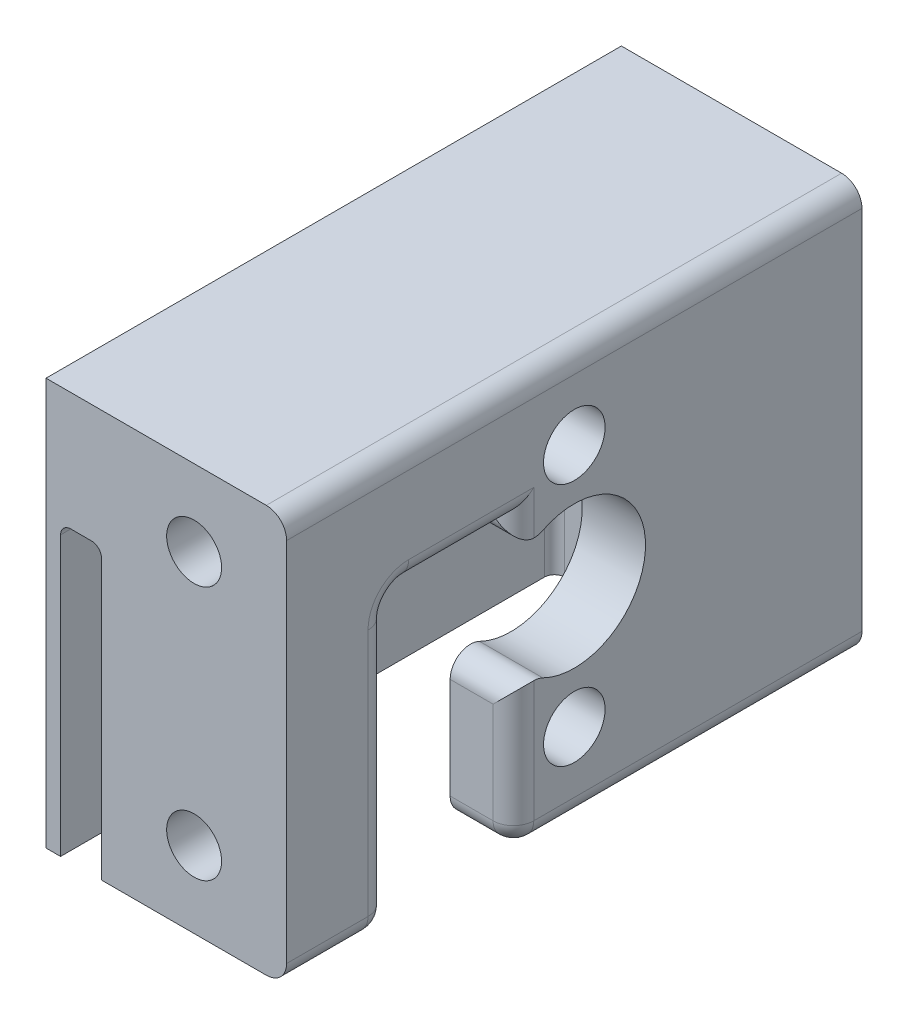
from build123d import *

# Parameters (mm, degrees)
SKETCH1_W           = 23.65
SKETCH1_H           = 40
BOSS_EXTRUDE1_DEPTH = 56.55
SKETCH2_W           = 16
SKETCH2_H           = 28.38
CUT_EXTRUDE1_DEPTH  = 62.137002911
SKETCH3_R           = 7
CUT_EXTRUDE2_DEPTH  = 6.2205
SKETCH6_R           = 3.025
CUT_EXTRUDE4_DEPTH  = 8
SKETCH4_W           = 11.968
SKETCH4_H           = 10
BOSS_EXTRUDE2_DEPTH = 28.38
SKETCH5_W           = 12.292
SKETCH5_H           = 28.38
CUT_EXTRUDE3_DEPTH  = 6.2205
FILLET5_R           = 2
SKETCH9_W           = 8
SKETCH9_H           = 11
BOSS_EXTRUDE3_DEPTH = 16
SKETCH8_R           = 2.7
CUT_EXTRUDE6_DEPTH  = 9
SKETCH7_R           = 2.7
CUT_EXTRUDE5_DEPTH  = 8
FILLET4_R           = 2
FILLET8_R           = 1


with BuildPart() as part:
    # Sketch1 → Boss-Extrude1 (new body)
    with BuildSketch(Plane.XY):
        Rectangle(SKETCH1_W, SKETCH1_H)
    extrude(amount=BOSS_EXTRUDE1_DEPTH)

    # Sketch2 → Cut-Extrude1 (cut, through all)
    with BuildSketch(Plane.XY.offset(56.55)):
        with Locations((-2.3955, -5.81)):
            Rectangle(SKETCH2_W, SKETCH2_H)
    extrude(amount=-CUT_EXTRUDE1_DEPTH, mode=Mode.SUBTRACT)

    # Sketch3 → Cut-Extrude2 (cut)
    with BuildSketch(Plane(origin=(11.825, 0, 0), x_dir=(0, 0, -1), z_dir=(1, 0, 0))):
        with Locations(Location((-28.275, 0, 0), (0, 0, 90))):
            Circle(SKETCH3_R)
    extrude(amount=-CUT_EXTRUDE2_DEPTH, mode=Mode.SUBTRACT)

    # Sketch6 → Cut-Extrude4 (cut)
    with BuildSketch(Plane(origin=(11.825, 0, 0), x_dir=(0, 0, -1), z_dir=(1, 0, 0))):
        with Locations(Location((-28.275, 12, 0), (0, 0, 90))):
            Circle(SKETCH6_R)
        with Locations(Location((-28.275, -12, 0), (0, 0, 90))):
            Circle(SKETCH6_R)
    extrude(amount=-CUT_EXTRUDE4_DEPTH, mode=Mode.SUBTRACT)

    # Sketch4 → Boss-Extrude2 (add)
    with BuildSketch(Plane.XZ.offset(-8.38)):
        with Locations((-0.3795, 51.55)):
            Rectangle(SKETCH4_W, SKETCH4_H)
    extrude(amount=BOSS_EXTRUDE2_DEPTH)

    # Sketch5 → Cut-Extrude3 (cut)
    with BuildSketch(Plane(origin=(11.825, 0, 0), x_dir=(0, 0, -1), z_dir=(1, 0, 0))):
        with Locations((-40.404, -5.81)):
            Rectangle(SKETCH5_W, SKETCH5_H)
    extrude(amount=-CUT_EXTRUDE3_DEPTH, mode=Mode.SUBTRACT)

    # Fillet5
    fillet5_edges = [part.edges().sort_by_distance(p)[0] for p in [
        (5.6045, 8.38, 17.129),
    ]]
    fillet(fillet5_edges, radius=FILLET5_R)

    # Sketch9 → Boss-Extrude3 (add)
    with BuildSketch(Plane(origin=(-10.3955, 0, 0), x_dir=(0, 0, -1), z_dir=(1, 0, 0))):
        with Locations((-4, -14.5)):
            Rectangle(SKETCH9_W, SKETCH9_H)
    extrude(amount=BOSS_EXTRUDE3_DEPTH)

    # Sketch8 → Cut-Extrude6 (cut)
    with BuildSketch(Plane(origin=(0, 0, 0), x_dir=(-1, 0, 0), z_dir=(0, 0, -1))):
        with Locations((0, 14.19)):
            Circle(SKETCH8_R)
        with Locations((0, -14.5)):
            Circle(SKETCH8_R)
    extrude(amount=-CUT_EXTRUDE6_DEPTH, mode=Mode.SUBTRACT)

    # Sketch7 → Cut-Extrude5 (cut)
    with BuildSketch(Plane.XY.offset(56.55)):
        with Locations((2.73075, 12.5)):
            Circle(SKETCH7_R)
        with Locations((2.73075, -12.5)):
            Circle(SKETCH7_R)
    extrude(amount=-CUT_EXTRUDE5_DEPTH, mode=Mode.SUBTRACT)

    # Fillet4
    fillet4_edges = [part.edges().sort_by_distance(p)[0] for p in [
        (5.6045, -14.5, 8),
        (5.6045, -9, 4),
        (2.73075, -20, 46.55),
        (2.73075, 8.38, 46.55),
        (8.71475, 3.633691099, 34.258),
        (8.71475, -3.633691099, 34.258),
        (11.825, -20, 17.129),
        (11.825, 8.38, 40.404),
        (11.825, -11.816845549, 34.258),
        (11.825, 6.006845549, 34.258),
        (11.825, -5.81, 46.55),
        (8.71475, -20, 34.258),
        (11.825, -20, 51.55),
        (11.825, 20, 28.275),
    ]]
    fillet(fillet4_edges, radius=FILLET4_R)

    # Fillet8
    fillet8_edges = [part.edges().sort_by_distance(p)[0] for p in [
        (-10.3955, -14.5, 8),
        (-10.3955, -9, 4),
        (-10.3955, 8.38, 28.275),
        (-6.3635, 8.38, 50.55),
    ]]
    fillet(fillet8_edges, radius=FILLET8_R)


solid = part.part
